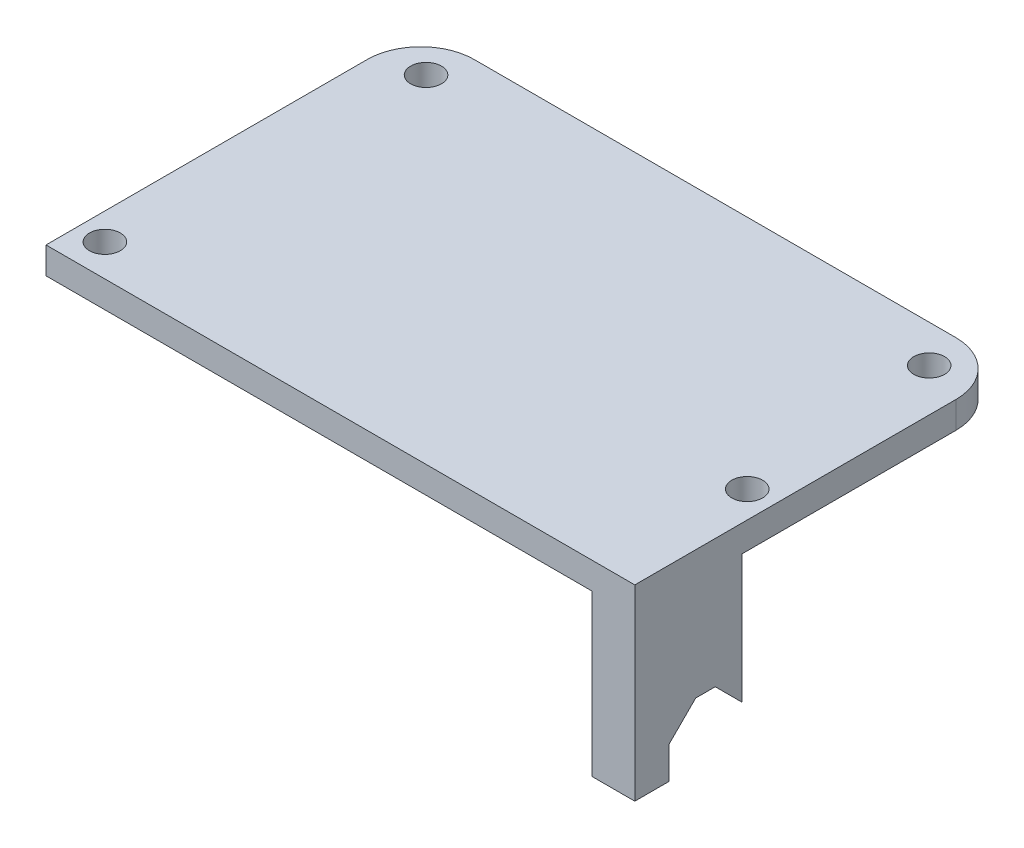
from build123d import *

# Parameters (mm, degrees)
SKETCH1_W                      = 69.85
SKETCH1_H                      = 44.45
BOSS_EXTRUDE1_DEPTH            = 3.175
BOSS_EXTRUDE2_DEPTH            = 5.08
FILLET1_R                      = 6.35
F_6_0_204_DIAMETER_HOLE1_D     = 3.6576
F_6_0_204_DIAMETER_HOLE1_DEPTH = 38.1
F_6_0_204_DIAMETER_HOLE1_TIP   = 1.0988539


with BuildPart() as part:
    # Sketch1 → Boss-Extrude1 (new body)
    with BuildSketch(Plane(origin=(0, 0, 0), x_dir=(1, 0, 0), z_dir=(0, 1, 0))):
        Rectangle(SKETCH1_W, SKETCH1_H)
    extrude(amount=BOSS_EXTRUDE1_DEPTH)

    # Sketch2 → Boss-Extrude2 (add)
    with BuildSketch(Plane(origin=(34.925, 0, 0), x_dir=(0, 0, -1), z_dir=(1, 0, 0))):
        Polygon((-22.225, 0), (-22.225, -19.05), (-18.161, -19.05), (-18.161, -15.2219533), (-15.0040594, -12.065), (-12.681966, -12.065), (-9.525, -15.2219533), (-9.525, 0), align=None)
    extrude(amount=-BOSS_EXTRUDE2_DEPTH)

    # Fillet1
    fillet1_edges = [part.edges().sort_by_distance(p)[0] for p in [
        (-34.925, 1.5875, -22.225),
        (34.925, 1.5875, -22.225),
    ]]
    fillet(fillet1_edges, radius=FILLET1_R)

    # #6 (0.204) Diameter Hole1
    with Locations(Plane(origin=(0, 0, 0), x_dir=(-1, 0, 0), z_dir=(0, -1, 0))):
        with Locations((-29.845, 17.78), (29.845, 17.78), (31.75, -18.415), (-31.75, -5.715)):
            Hole(F_6_0_204_DIAMETER_HOLE1_D / 2, depth=F_6_0_204_DIAMETER_HOLE1_DEPTH)
            with Locations((0, 0, -(F_6_0_204_DIAMETER_HOLE1_DEPTH + F_6_0_204_DIAMETER_HOLE1_TIP / 2))):  # 118° drill point
                Cone(0, F_6_0_204_DIAMETER_HOLE1_D / 2, F_6_0_204_DIAMETER_HOLE1_TIP, mode=Mode.SUBTRACT)


solid = part.part
